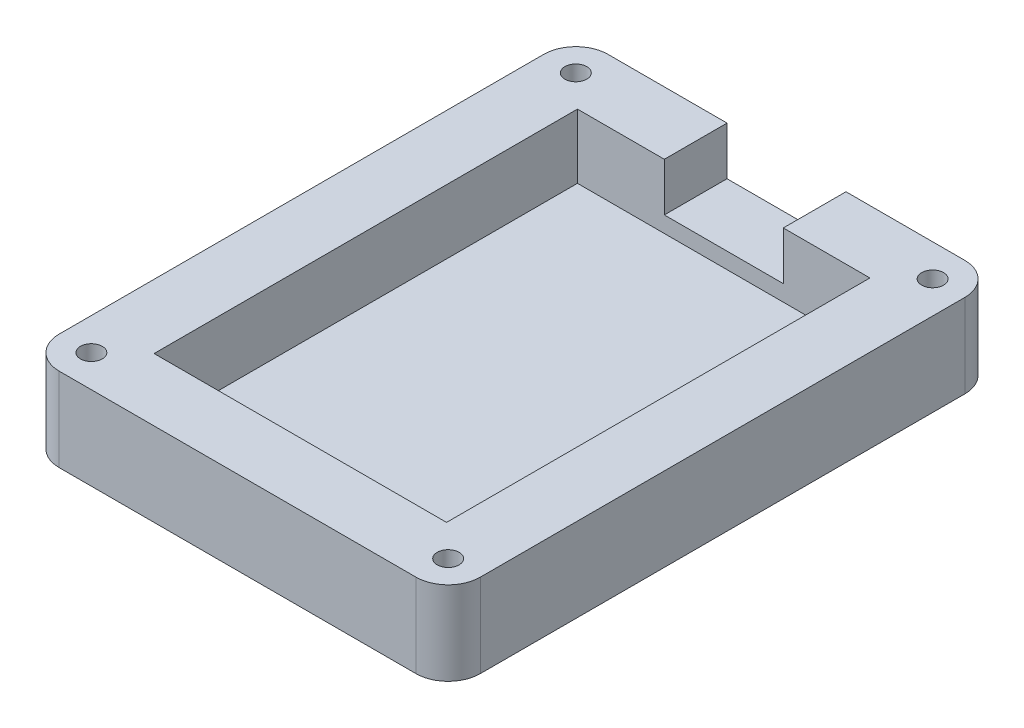
from build123d import *

# Parameters (mm, degrees)
BOSS_EXTRUDE1_START   = 3.1
SKETCH1_R             = 3
SKETCH1_R_2           = 1.7
BOSS_EXTRUDE1_DEPTH   = 9.9
BOSS_EXTRUDE1_2_DEPTH = 9.9
BOSS_EXTRUDE1_3_DEPTH = 9.9
BOSS_EXTRUDE1_4_DEPTH = 9.9
SKETCH1_5_W           = 65.49
SKETCH1_5_H           = 85.35
SKETCH1_5_R           = 3
SKETCH1_5_W_2         = 45.49
SKETCH1_5_H_2         = 65.85
BOSS_EXTRUDE2_DEPTH   = 13
SKETCH1_6_W           = 45.49
SKETCH1_6_H           = 65.85
BOSS_EXTRUDE3_DEPTH   = 3
SKETCH3_W             = 18.5
SKETCH3_H             = 9.75
CUT_EXTRUDE1_DEPTH    = 7.5
FILLET1_R             = 5
SKETCH4_W             = 0.32987013
SKETCH4_H             = 0.453571428
SKETCH4_H_2           = 2.30909091
CUT_EXTRUDE2_DEPTH    = 0.2


with BuildPart() as part:
    # Sketch1 → Boss-Extrude1 (new body)
    with BuildSketch(Plane(origin=(0, 0, 0), x_dir=(1, 0, 0), z_dir=(0, 1, 0)).offset(BOSS_EXTRUDE1_START)):
        with Locations((-27.745, -37.675)):
            Circle(SKETCH1_R)
        with Locations((-27.745, -37.675)):
            Circle(SKETCH1_R_2, mode=Mode.SUBTRACT)
    extrude(amount=BOSS_EXTRUDE1_DEPTH)



with BuildPart() as body_2:
    # Sketch1 → Boss-Extrude1 2 (new body)
    with BuildSketch(Plane(origin=(0, 0, 0), x_dir=(1, 0, 0), z_dir=(0, 1, 0)).offset(BOSS_EXTRUDE1_START)):
        with Locations((27.745, 37.675)):
            Circle(SKETCH1_R)
        with Locations((27.745, 37.675)):
            Circle(SKETCH1_R_2, mode=Mode.SUBTRACT)
    extrude(amount=BOSS_EXTRUDE1_2_DEPTH)


with BuildPart() as body_3:
    # Sketch1 → Boss-Extrude1 3 (new body)
    with BuildSketch(Plane(origin=(0, 0, 0), x_dir=(1, 0, 0), z_dir=(0, 1, 0)).offset(BOSS_EXTRUDE1_START)):
        with Locations((-27.745, 37.675)):
            Circle(SKETCH1_R)
        with Locations((-27.745, 37.675)):
            Circle(SKETCH1_R_2, mode=Mode.SUBTRACT)
    extrude(amount=BOSS_EXTRUDE1_3_DEPTH)


with BuildPart() as body_4:
    # Sketch1 → Boss-Extrude1 4 (new body)
    with BuildSketch(Plane(origin=(0, 0, 0), x_dir=(1, 0, 0), z_dir=(0, 1, 0)).offset(BOSS_EXTRUDE1_START)):
        with Locations((27.745, -37.675)):
            Circle(SKETCH1_R)
        with Locations((27.745, -37.675)):
            Circle(SKETCH1_R_2, mode=Mode.SUBTRACT)
    extrude(amount=BOSS_EXTRUDE1_4_DEPTH)


with BuildPart() as part_1:
    add(part.part)

    add(body_2.part)  # Boss-Extrude2 merges body 2

    add(body_3.part)  # Boss-Extrude2 merges body 3

    add(body_4.part)  # Boss-Extrude2 merges body 4
    # Sketch1<5> → Boss-Extrude2 (add)
    with BuildSketch(Plane(origin=(0, 0, 0), x_dir=(1, 0, 0), z_dir=(0, 1, 0))):
        Rectangle(SKETCH1_5_W, SKETCH1_5_H)
        with Locations((-27.745, -37.675)):
            Circle(SKETCH1_5_R, mode=Mode.SUBTRACT)
        with Locations((27.745, -37.675)):
            Circle(SKETCH1_5_R, mode=Mode.SUBTRACT)
        with Locations((-27.745, 37.675)):
            Circle(SKETCH1_5_R, mode=Mode.SUBTRACT)
        Rectangle(SKETCH1_5_W_2, SKETCH1_5_H_2, mode=Mode.SUBTRACT)
        with Locations((27.745, 37.675)):
            Circle(SKETCH1_5_R, mode=Mode.SUBTRACT)
    extrude(amount=BOSS_EXTRUDE2_DEPTH)

    # Sketch1<6> → Boss-Extrude3 (add)
    with BuildSketch(Plane(origin=(0, 0, 0), x_dir=(1, 0, 0), z_dir=(0, 1, 0))):
        Rectangle(SKETCH1_6_W, SKETCH1_6_H)
    extrude(amount=BOSS_EXTRUDE3_DEPTH)

    # Sketch3 → Cut-Extrude1 (cut)
    with BuildSketch(Plane(origin=(0, 13, 0), x_dir=(1, 0, 0), z_dir=(0, 1, 0))):
        with Locations((0.02, 37.8)):
            Rectangle(SKETCH3_W, SKETCH3_H)
    extrude(amount=-CUT_EXTRUDE1_DEPTH, mode=Mode.SUBTRACT)

    # Fillet1
    fillet1_edges = [part_1.edges().sort_by_distance(p)[0] for p in [
        (32.745, 6.5, -42.675),
        (-32.745, 6.5, -42.675),
        (-32.745, 6.5, 42.675),
        (32.745, 6.5, 42.675),
    ]]
    fillet(fillet1_edges, radius=FILLET1_R)

    # Sketch4 → Cut-Extrude2 (cut)
    # profile 1 of 12: a face of its own
    with BuildSketch(Plane.XZ):
        with BuildLine():
            Line((-10.153954036, 36.930294388), (-10.153954036, 37.316860947))
            Line((-10.153954036, 37.316860947), (-8.798393971, 39.355999543))
            add(Edge.make_bspline(
                [(-8.798393971, 39.355999543), (-8.775140859, 39.390682703), (-8.72975405, 39.458379362), (-8.660564953, 39.555893365), (-8.592471126, 39.647585696), (-8.546002443, 39.705755633), (-8.523287437, 39.734190492)],
                knots=[0, 0, 0, 0, 1.071007658, 2.09045659, 3.066569397, 4, 4, 4, 4], degree=3))
            Line((-8.523287437, 39.734190492), (-9.989018971, 39.734190492))
            Line((-9.989018971, 39.734190492), (-9.989018971, 40.105294388))
            Line((-9.989018971, 40.105294388), (-8.133499491, 40.105294388))
            Line((-8.133499491, 40.105294388), (-8.133499491, 39.734190492))
            Line((-8.133499491, 39.734190492), (-9.614693687, 37.524962611))
            Line((-9.614693687, 37.524962611), (-9.775118809, 37.301398285))
            Line((-9.775118809, 37.301398285), (-8.092265724, 37.301398285))
            Line((-8.092265724, 37.301398285), (-8.092265724, 36.930294388))
            Line((-8.092265724, 36.930294388), (-10.153954036, 36.930294388))
        make_face()
    # profile 2 of 12: a face of its own
    with BuildSketch(Plane.XZ):
        with BuildLine():
            add(Edge.make_bspline(
                [(-6.484148841, 37.248567522), (-6.51119617, 37.220197822), (-6.563779804, 37.165043322), (-6.648008255, 37.091861054), (-6.733910635, 37.029537785), (-6.821600008, 36.978211216), (-6.911151583, 36.938645122), (-7.001996437, 36.909803883), (-7.094913515, 36.892547741), (-7.157563401, 36.890225471), (-7.188988533, 36.889060622)],
                knots=[0, 0, 0, 0, 1.153539222, 2.242634972, 3.279759983, 4.274221825, 5.22822196, 6.156113319, 7.075107937, 8, 8, 8, 8], degree=3))
            add(Edge.make_bspline(
                [(-7.188988533, 36.889060622), (-7.213286595, 36.889458684), (-7.26074724, 36.890236204), (-7.330076767, 36.899144422), (-7.395825985, 36.912053999), (-7.457559482, 36.931920333), (-7.515912211, 36.956075851), (-7.570135083, 36.986707939), (-7.620938745, 37.02220796), (-7.667066597, 37.063604708), (-7.709095858, 37.109083477), (-7.745282284, 37.159231866), (-7.776466192, 37.212834037), (-7.80170181, 37.270563944), (-7.820750435, 37.332029683), (-7.835191034, 37.397052096), (-7.843563303, 37.465897643), (-7.844424259, 37.513128328), (-7.844863127, 37.537203885)],
                knots=[0, 0, 0, 0, 1.119001789, 2.185711136, 3.216323131, 4.202252203, 5.169072212, 6.121655869, 7.066185889, 8.01954035, 8.972175414, 9.914421449, 10.863296537, 11.8249363, 12.810865371, 13.824179086, 14.890888434, 16, 16, 16, 16], degree=3))
            add(Edge.make_bspline(
                [(-7.844863127, 37.537203885), (-7.844009478, 37.569282536), (-7.842347857, 37.631723347), (-7.8254319, 37.722342882), (-7.799412908, 37.807503397), (-7.761607044, 37.886437764), (-7.714844398, 37.958207134), (-7.6599792, 38.022516223), (-7.597044135, 38.078132433), (-7.538079041, 38.117759919), (-7.485670392, 38.145243414), (-7.441206431, 38.164327769), (-7.39213957, 38.182272871), (-7.338497028, 38.199245985), (-7.279852967, 38.213656244), (-7.216485622, 38.227274139), (-7.148352205, 38.239436488), (-7.101173252, 38.246261305), (-7.076884231, 38.249774908)],
                knots=[0, 0, 0, 0, 1.315736636, 2.561069718, 3.771447986, 4.962594692, 6.141438714, 7.279577219, 8.422657877, 9.579430637, 10.186831949, 10.850275834, 11.564458882, 12.331400109, 13.159047923, 14.042804356, 14.992381924, 16, 16, 16, 16], degree=3))
            add(Edge.make_bspline(
                [(-7.076884231, 38.249774908), (-7.044202564, 38.255370553), (-6.981046813, 38.266183868), (-6.890267605, 38.285121927), (-6.805946337, 38.304235379), (-6.72872959, 38.324910123), (-6.657625728, 38.345339377), (-6.593647347, 38.367247124), (-6.535859852, 38.389228695), (-6.500788101, 38.40651076), (-6.484148841, 38.414709973)],
                knots=[0, 0, 0, 0, 1.28905306, 2.491033145, 3.605049172, 4.650122195, 5.598672662, 6.480605859, 7.279146522, 8, 8, 8, 8], degree=3))
            Line((-6.484148841, 38.414709973), (-6.484148841, 38.508774502))
            add(Edge.make_bspline(
                [(-6.484148841, 38.508774502), (-6.484286612, 38.52661465), (-6.484551032, 38.560854738), (-6.489587526, 38.610047617), (-6.495518197, 38.655367401), (-6.504943971, 38.696688643), (-6.518208818, 38.733533584), (-6.532738782, 38.766913447), (-6.550581184, 38.79616701), (-6.565295616, 38.812636471), (-6.572414872, 38.820604859)],
                knots=[0, 0, 0, 0, 1.290137808, 2.476124807, 3.574920544, 4.596386969, 5.535069845, 6.404438809, 7.22802268, 8, 8, 8, 8], degree=3))
            add(Edge.make_bspline(
                [(-6.572414872, 38.820604859), (-6.583103494, 38.831007955), (-6.604738728, 38.852065246), (-6.642704675, 38.878393021), (-6.684719605, 38.900864327), (-6.730641348, 38.919654317), (-6.78076437, 38.933940148), (-6.835250284, 38.942996062), (-6.893732722, 38.949964427), (-6.934260876, 38.950482398), (-6.955115765, 38.950748934)],
                knots=[0, 0, 0, 0, 0.860333652, 1.741433159, 2.657216257, 3.608602534, 4.602004448, 5.660502074, 6.796146289, 8, 8, 8, 8], degree=3))
            add(Edge.make_bspline(
                [(-6.955115765, 38.950748934), (-6.991712264, 38.950067831), (-7.06019789, 38.948793235), (-7.155740744, 38.931585571), (-7.237368444, 38.905714521), (-7.294978886, 38.872864745), (-7.33318147, 38.839853691), (-7.359495651, 38.810977626), (-7.383337969, 38.777013872), (-7.405245592, 38.738498757), (-7.425961783, 38.695612282), (-7.443612844, 38.647281605), (-7.460720015, 38.594805346), (-7.469321575, 38.557603953), (-7.473759231, 38.538411272)],
                knots=[0, 0, 0, 0, 1.779102865, 3.329361478, 4.707868851, 5.930643941, 6.523657754, 7.16004944, 7.827207895, 8.539060925, 9.31524689, 10.142348672, 11.041613586, 12, 12, 12, 12], degree=3))
            Line((-7.473759231, 38.538411272), (-7.803629361, 38.579645038))
            add(Edge.make_bspline(
                [(-7.803629361, 38.579645038), (-7.797300937, 38.609143139), (-7.784969519, 38.666622445), (-7.761469669, 38.749356534), (-7.732217475, 38.825705935), (-7.699049174, 38.895870119), (-7.661298211, 38.959689721), (-7.619598845, 39.017628561), (-7.572054381, 39.068425297), (-7.520895772, 39.114282305), (-7.463983437, 39.153981829), (-7.40151679, 39.188057055), (-7.333052735, 39.216192598), (-7.259559277, 39.240421052), (-7.179801361, 39.257815159), (-7.094691302, 39.271679456), (-7.003571433, 39.279180492), (-6.940953952, 39.280130263), (-6.908727778, 39.280619064)],
                knots=[0, 0, 0, 0, 1.146744962, 2.234520216, 3.265547189, 4.251500875, 5.181194384, 6.080940409, 6.959092981, 7.820811418, 8.688273039, 9.590681915, 10.520124471, 11.498613844, 12.528476545, 13.619677679, 14.774963812, 16, 16, 16, 16], degree=3))
            add(Edge.make_bspline(
                [(-6.908727778, 39.280619064), (-6.883590936, 39.280228748), (-6.834766532, 39.279470622), (-6.763597413, 39.274163371), (-6.696625921, 39.266128054), (-6.633705974, 39.253975368), (-6.575156371, 39.237520508), (-6.520120432, 39.219347958), (-6.469540726, 39.196793638), (-6.409794392, 39.161850744), (-6.344086196, 39.113309147), (-6.278086465, 39.047704341), (-6.22977669, 38.973578788), (-6.203210805, 38.906153384), (-6.189074715, 38.848119608), (-6.179301554, 38.800013059), (-6.171845517, 38.746839209), (-6.165434635, 38.689041606), (-6.160397445, 38.626515475), (-6.156376495, 38.559505241), (-6.1546681, 38.487737217), (-6.154411469, 38.438333912), (-6.154278711, 38.41277714)],
                knots=[0, 0, 0, 0, 1.116479382, 2.168587404, 3.16840818, 4.111316371, 5.011567079, 5.868311402, 6.683862369, 7.465978748, 8.938885496, 10.301521261, 11.576846205, 12.839874513, 13.499268829, 14.228894422, 15.019458851, 15.883290383, 16.811756148, 17.805505868, 18.864768531, 20, 20, 20, 20], degree=3))
            Line((-6.154278711, 38.41277714), (-6.154278711, 37.893489397))
            add(Edge.make_bspline(
                [(-6.154278711, 37.893489397), (-6.154418221, 37.85010716), (-6.154683434, 37.767635598), (-6.152906608, 37.650168508), (-6.152059679, 37.545354349), (-6.149711442, 37.45302179), (-6.148465101, 37.373303924), (-6.144812257, 37.306328244), (-6.142004696, 37.251942152), (-6.134766413, 37.172825642), (-6.115504284, 37.065439676), (-6.086369546, 36.975324256), (-6.071811179, 36.930294388)],
                knots=[0, 0, 0, 0, 1.33924071, 2.545956183, 3.626711962, 4.574996917, 5.397345641, 6.087652113, 6.645549812, 7.078325684, 8.540065522, 10, 10, 10, 10], degree=3))
            Line((-6.071811179, 36.930294388), (-6.401681309, 36.930294388))
            add(Edge.make_bspline(
                [(-6.401681309, 36.930294388), (-6.411835741, 36.953520035), (-6.432613532, 37.001043877), (-6.455231289, 37.078124631), (-6.473579444, 37.160968375), (-6.480563089, 37.218848817), (-6.484148841, 37.248567522)],
                knots=[0, 0, 0, 0, 0.920202936, 1.882900402, 2.912975517, 4, 4, 4, 4], degree=3))
        make_face()
        with BuildLine():
            add(Edge.make_bspline(
                [(-6.484148841, 38.084839843), (-6.500612846, 38.076738216), (-6.534866969, 38.059882407), (-6.58985572, 38.036702593), (-6.65051178, 38.014808962), (-6.717186321, 37.994640088), (-6.78915199, 37.973666676), (-6.867016953, 37.954624504), (-6.9504162, 37.936587879), (-7.007922017, 37.925581715), (-7.037583298, 37.919904778)],
                knots=[0, 0, 0, 0, 0.759937497, 1.581085096, 2.470290631, 3.429739441, 4.465916236, 5.57487507, 6.749129853, 8, 8, 8, 8], degree=3))
            add(Edge.make_bspline(
                [(-7.037583298, 37.919904778), (-7.070479327, 37.914551228), (-7.131104295, 37.904685028), (-7.214140848, 37.887851914), (-7.28094838, 37.868963113), (-7.333930949, 37.848757293), (-7.376049193, 37.825011339), (-7.41184529, 37.797721093), (-7.443159356, 37.766022666), (-7.468788571, 37.72967895), (-7.489536728, 37.690317138), (-7.504739819, 37.647879857), (-7.512869962, 37.602369766), (-7.514275739, 37.571165008), (-7.514992997, 37.555243658)],
                knots=[0, 0, 0, 0, 1.792080477, 3.302672748, 4.55256871, 5.521793876, 6.343933024, 7.143043091, 7.93511388, 8.729789758, 9.525220353, 10.321404951, 11.1435441, 12, 12, 12, 12], degree=3))
            add(Edge.make_bspline(
                [(-7.514992997, 37.555243658), (-7.514030311, 37.530786508), (-7.512176617, 37.483693183), (-7.489989342, 37.417299243), (-7.456463456, 37.35797038), (-7.408185293, 37.307819282), (-7.348259523, 37.267543468), (-7.277034085, 37.239464186), (-7.196077406, 37.221745041), (-7.138621002, 37.21989966), (-7.108453833, 37.218930752)],
                knots=[0, 0, 0, 0, 0.982989349, 1.89278952, 2.793465746, 3.712871111, 4.674195932, 5.684718148, 6.784373966, 8, 8, 8, 8], degree=3))
            add(Edge.make_bspline(
                [(-7.108453833, 37.218930752), (-7.078949687, 37.219821958), (-7.020773246, 37.221579243), (-6.93573785, 37.238524247), (-6.854473064, 37.264622534), (-6.778677998, 37.302309786), (-6.70931755, 37.348107943), (-6.64866269, 37.402243531), (-6.597158368, 37.46322932), (-6.562303978, 37.520454325), (-6.539263352, 37.57061825), (-6.524437449, 37.612686169), (-6.512722942, 37.658761757), (-6.501068885, 37.70839717), (-6.494102564, 37.762591214), (-6.48799326, 37.820565045), (-6.485026097, 37.882721865), (-6.484447927, 37.925486636), (-6.484148841, 37.947608715)],
                knots=[0, 0, 0, 0, 1.295816986, 2.555099171, 3.797272685, 5.038800039, 6.264426397, 7.441439978, 8.600861566, 9.761973723, 10.374641393, 11.025690135, 11.719692907, 12.46426932, 13.265486335, 14.119543836, 15.027246062, 16, 16, 16, 16], degree=3))
            Line((-6.484148841, 37.947608715), (-6.484148841, 38.084839843))
        make_face(mode=Mode.SUBTRACT)
    # profile 3 of 12: a face of its own
    with BuildSketch(Plane.XZ):
        with BuildLine():
            Line((-5.741941049, 36.064385298), (-5.783174815, 36.47672296))
            add(Edge.make_bspline(
                [(-5.783174815, 36.47672296), (-5.768240948, 36.470436558), (-5.739836042, 36.45847953), (-5.697975131, 36.445711429), (-5.659391087, 36.437137352), (-5.63460082, 36.436022267), (-5.622749694, 36.435489194)],
                knots=[0, 0, 0, 0, 1.165471902, 2.21678153, 3.147522386, 4, 4, 4, 4], degree=3))
            add(Edge.make_bspline(
                [(-5.622749694, 36.435489194), (-5.608340511, 36.435831141), (-5.580683776, 36.436487467), (-5.541308304, 36.442225682), (-5.505958297, 36.45182863), (-5.474201847, 36.465606761), (-5.445744791, 36.483701465), (-5.420210695, 36.506313666), (-5.396633545, 36.532550225), (-5.384255886, 36.553158473), (-5.377924207, 36.563700436)],
                knots=[0, 0, 0, 0, 1.185035572, 2.274536785, 3.264811362, 4.190559477, 5.112082338, 6.026292085, 6.990367657, 8, 8, 8, 8], degree=3))
            add(Edge.make_bspline(
                [(-5.377924207, 36.563700436), (-5.376184213, 36.56777186), (-5.371105264, 36.579656128), (-5.362074907, 36.603866178), (-5.350138967, 36.640489784), (-5.334801856, 36.689563006), (-5.315322046, 36.750936824), (-5.292291109, 36.824583333), (-5.265673821, 36.910641587), (-5.247294356, 36.972155356), (-5.23747169, 37.00503059)],
                knots=[0, 0, 0, 0, 0.229371289, 0.669522359, 1.338017403, 2.224764623, 3.333198648, 4.673933361, 6.222426913, 8, 8, 8, 8], degree=3))
            Line((-5.23747169, 37.00503059), (-5.906876114, 39.239385298))
            Line((-5.906876114, 39.239385298), (-5.56476471, 39.239385298))
            Line((-5.56476471, 39.239385298), (-5.208479198, 37.9997952))
            add(Edge.make_bspline(
                [(-5.208479198, 37.9997952), (-5.186587111, 37.920061793), (-5.141519233, 37.755919588), (-5.104472935, 37.589781099), (-5.085422177, 37.504345728)],
                knots=[0, 0, 0, 0, 0.971516218, 2, 2, 2, 2], degree=3))
            add(Edge.make_bspline(
                [(-5.085422177, 37.504345728), (-5.066862544, 37.586857172), (-5.029949821, 37.750961825), (-4.981366616, 37.911996874), (-4.957210936, 37.992063869)],
                knots=[0, 0, 0, 0, 1.005595425, 2, 2, 2, 2], degree=3))
            Line((-4.957210936, 37.992063869), (-4.55904738, 39.239385298))
            Line((-4.55904738, 39.239385298), (-4.216291698, 39.239385298))
            Line((-4.216291698, 39.239385298), (-4.929506999, 36.890993455))
            add(Edge.make_bspline(
                [(-4.929506999, 36.890993455), (-4.940414422, 36.855759002), (-4.961324013, 36.788214363), (-4.992068601, 36.691436868), (-5.021645061, 36.604068614), (-5.049525198, 36.525734196), (-5.075047162, 36.456483752), (-5.098530153, 36.396290629), (-5.121405255, 36.345804457), (-5.147809619, 36.291246788), (-5.181806577, 36.234152936), (-5.223782611, 36.174414543), (-5.270203937, 36.12626086), (-5.318727078, 36.087385876), (-5.370834247, 36.058724161), (-5.425566723, 36.037668428), (-5.483883813, 36.025195414), (-5.523901649, 36.02383819), (-5.544147827, 36.023151531)],
                knots=[0, 0, 0, 0, 1.54772604, 2.966999321, 4.260793617, 5.418012451, 6.455881169, 7.357858617, 8.128290321, 8.781185485, 9.9001574, 10.913198716, 11.83736709, 12.697308749, 13.512204708, 14.32225288, 15.151179359, 16, 16, 16, 16], degree=3))
            add(Edge.make_bspline(
                [(-5.544147827, 36.023151531), (-5.5592106, 36.023688917), (-5.590590711, 36.024808447), (-5.638876965, 36.03307706), (-5.689978565, 36.045887492), (-5.724208373, 36.058072751), (-5.741941049, 36.064385298)],
                knots=[0, 0, 0, 0, 0.889897906, 1.853914517, 2.888225146, 4, 4, 4, 4], degree=3))
        make_face()
    # profile 4 of 12: a face of its own
    with BuildSketch(Plane.XZ):
        with BuildLine():
            Line((-2.731876114, 36.930294388), (-2.731876114, 37.240191913))
            add(Edge.make_bspline(
                [(-2.731876114, 37.240191913), (-2.746422798, 37.212912474), (-2.774711161, 37.159863224), (-2.827826947, 37.089343604), (-2.885799702, 37.02775422), (-2.950423512, 36.97768803), (-3.018825405, 36.937880776), (-3.090783929, 36.909913692), (-3.165504492, 36.892473706), (-3.216494503, 36.890202903), (-3.242143971, 36.889060622)],
                knots=[0, 0, 0, 0, 1.133989571, 2.205224826, 3.231789394, 4.232199063, 5.19692309, 6.128572225, 7.058617027, 8, 8, 8, 8], degree=3))
            add(Edge.make_bspline(
                [(-3.242143971, 36.889060622), (-3.26904683, 36.890143816), (-3.322364558, 36.892290555), (-3.401082764, 36.906689358), (-3.477143222, 36.931357322), (-3.550017356, 36.966581569), (-3.620266365, 37.010862497), (-3.687712318, 37.064850342), (-3.751996294, 37.128993988), (-3.813154335, 37.202298424), (-3.869008619, 37.284615293), (-3.918361536, 37.375313259), (-3.959211422, 37.474432876), (-3.99349468, 37.581025346), (-4.019785164, 37.695705518), (-4.038176954, 37.818256282), (-4.049134682, 37.948911992), (-4.050601507, 38.038644993), (-4.051356634, 38.084839843)],
                knots=[0, 0, 0, 0, 0.80447131, 1.594350407, 2.384438369, 3.188807121, 4.008491784, 4.86308786, 5.766854884, 6.719939474, 7.713954355, 8.737069496, 9.802239073, 10.915301486, 12.082206997, 13.316639229, 14.618596865, 16, 16, 16, 16], degree=3))
            add(Edge.make_bspline(
                [(-4.051356634, 38.084839843), (-4.050873193, 38.116627225), (-4.049922182, 38.179158552), (-4.045772128, 38.271189151), (-4.037223419, 38.35950707), (-4.025762407, 38.444004424), (-4.010898645, 38.524837013), (-3.992986364, 38.602062608), (-3.971809634, 38.675659453), (-3.947199782, 38.745235812), (-3.920353486, 38.810939251), (-3.890639911, 38.872479925), (-3.858339463, 38.929420291), (-3.825258886, 38.982751694), (-3.788691707, 39.03075885), (-3.749963062, 39.074488362), (-3.709740807, 39.114663152), (-3.6530495, 39.160673748), (-3.578062865, 39.2085291), (-3.481824487, 39.250303452), (-3.380255225, 39.27582845), (-3.31079744, 39.279009305), (-3.275646406, 39.280619064)],
                knots=[0, 0, 0, 0, 1.200092811, 2.360791942, 3.476449651, 4.548454459, 5.57884996, 6.577830464, 7.53997948, 8.46815932, 9.362439314, 10.218148121, 11.045744559, 11.832923925, 12.585266996, 13.320466941, 14.037060379, 14.728399049, 16.073317711, 17.380543445, 18.674351532, 20, 20, 20, 20], degree=3))
            add(Edge.make_bspline(
                [(-3.275646406, 39.280619064), (-3.250434475, 39.279686938), (-3.200341848, 39.277834933), (-3.126846089, 39.261124983), (-3.056520629, 39.233569893), (-2.989386005, 39.195987827), (-2.926379104, 39.14896686), (-2.86852408, 39.092964389), (-2.816570607, 39.028193225), (-2.787794546, 38.979902195), (-2.77310988, 38.955258877)],
                knots=[0, 0, 0, 0, 0.96180372, 1.910971261, 2.861342746, 3.837963269, 4.840179112, 5.855199082, 6.905490109, 8, 8, 8, 8], degree=3))
            Line((-2.77310988, 38.955258877), (-2.77310988, 40.105294388))
            Line((-2.77310988, 40.105294388), (-2.402005984, 40.105294388))
            Line((-2.402005984, 40.105294388), (-2.402005984, 36.930294388))
            Line((-2.402005984, 36.930294388), (-2.731876114, 36.930294388))
        make_face()
        with BuildLine():
            add(Edge.make_bspline(
                [(-3.721486504, 38.08290701), (-3.720980443, 38.047458422), (-3.720000994, 37.978849933), (-3.712838626, 37.879715852), (-3.701607828, 37.787546139), (-3.68479875, 37.70255952), (-3.66394474, 37.624155346), (-3.63742949, 37.553051631), (-3.606648879, 37.488801075), (-3.571128928, 37.431962138), (-3.532239127, 37.382280998), (-3.491636326, 37.338757596), (-3.449309197, 37.301983074), (-3.405351663, 37.27193901), (-3.360417733, 37.24727413), (-3.312664936, 37.231816795), (-3.264146257, 37.22052394), (-3.231042807, 37.219462906), (-3.214440035, 37.218930752)],
                knots=[0, 0, 0, 0, 1.533575963, 2.968138773, 4.298114002, 5.54818033, 6.713535028, 7.804307417, 8.826602252, 9.790834069, 10.697855259, 11.552385841, 12.362681251, 13.117825955, 13.853512655, 14.570478034, 15.283034621, 16, 16, 16, 16], degree=3))
            add(Edge.make_bspline(
                [(-3.214440035, 37.218930752), (-3.198070527, 37.219541923), (-3.165473216, 37.220758973), (-3.117349673, 37.230856809), (-3.071063917, 37.246955306), (-3.026232183, 37.269169721), (-2.983973954, 37.298748156), (-2.942146121, 37.333503436), (-2.903264031, 37.375806891), (-2.865735024, 37.423646757), (-2.830398311, 37.477589554), (-2.80157998, 37.539378538), (-2.775128413, 37.606674401), (-2.755094462, 37.681100372), (-2.739056453, 37.761818343), (-2.727440519, 37.848959088), (-2.721365604, 37.942582402), (-2.720224057, 38.00708909), (-2.71963484, 38.040384689)],
                knots=[0, 0, 0, 0, 0.738130652, 1.469871548, 2.208510992, 2.945304392, 3.719456284, 4.530982887, 5.394868195, 6.306056086, 7.273827841, 8.29675308, 9.376626023, 10.533467898, 11.768870438, 13.088773566, 14.497349183, 16, 16, 16, 16], degree=3))
            add(Edge.make_bspline(
                [(-2.71963484, 38.040384689), (-2.720219703, 38.07861874), (-2.721347571, 38.152350537), (-2.727412793, 38.259052989), (-2.739025664, 38.357772706), (-2.754926629, 38.448601953), (-2.775035596, 38.531556093), (-2.801211141, 38.605876788), (-2.830346916, 38.67305123), (-2.865338814, 38.731725956), (-2.903760455, 38.782777714), (-2.943753828, 38.8279846), (-2.986675906, 38.866074928), (-3.032418883, 38.896595192), (-3.080072562, 38.921047962), (-3.130371453, 38.93832529), (-3.183268726, 38.949135574), (-3.219327229, 38.950205656), (-3.237634028, 38.950748934)],
                knots=[0, 0, 0, 0, 1.573905954, 3.035171796, 4.397009854, 5.662881359, 6.829217105, 7.905549714, 8.902740008, 9.838145653, 10.709765189, 11.529785453, 12.318969519, 13.06430776, 13.787779745, 14.517436054, 15.247306526, 16, 16, 16, 16], degree=3))
            add(Edge.make_bspline(
                [(-3.237634028, 38.950748934), (-3.253998278, 38.950129678), (-3.286374604, 38.948904494), (-3.334047389, 38.939089393), (-3.379275237, 38.921857177), (-3.423302241, 38.899181894), (-3.465064227, 38.868935276), (-3.506095901, 38.8330453), (-3.543560669, 38.789035377), (-3.58086546, 38.740287324), (-3.614512127, 38.683850578), (-3.643215616, 38.619749698), (-3.667736432, 38.548367398), (-3.687389856, 38.469653373), (-3.702847109, 38.383551621), (-3.713281876, 38.289918306), (-3.720847546, 38.188906358), (-3.721268925, 38.11900215), (-3.721486504, 38.08290701)],
                knots=[0, 0, 0, 0, 0.713457296, 1.411560271, 2.111044511, 2.819131589, 3.565057044, 4.354641503, 5.190909952, 6.0808078, 7.030242707, 8.048917332, 9.139076782, 10.318209453, 11.584188125, 12.951756445, 14.426035021, 16, 16, 16, 16], degree=3))
        make_face(mode=Mode.SUBTRACT)
    # profile 5 of 12: a face of its own
    with BuildSketch(Plane.XZ):
        Polygon((-1.914932121, 38.9919827), (-1.989668322, 39.569255427), (-1.989668322, 40.105294388), (-1.659798192, 40.105294388), (-1.659798192, 39.569255427), (-1.736467226, 38.9919827), align=None)
    # profile 6 of 12: a face of its own
    with BuildSketch(Plane.XZ):
        with BuildLine():
            Line((-1.371161828, 37.631268414), (-1.041291698, 37.672502181))
            add(Edge.make_bspline(
                [(-1.041291698, 37.672502181), (-1.03570969, 37.636401398), (-1.025128819, 37.567971246), (-0.99333532, 37.473502583), (-0.949729971, 37.393363606), (-0.89289338, 37.328300314), (-0.824467697, 37.278540383), (-0.745629295, 37.243572838), (-0.656870134, 37.222660809), (-0.594496644, 37.220209753), (-0.561949166, 37.218930752)],
                knots=[0, 0, 0, 0, 1.189281864, 2.254320617, 3.232274242, 4.145201865, 5.047107826, 5.968481238, 6.939921219, 8, 8, 8, 8], degree=3))
            add(Edge.make_bspline(
                [(-0.561949166, 37.218930752), (-0.529629474, 37.220055858), (-0.468464593, 37.222185117), (-0.382255851, 37.241020822), (-0.307194058, 37.272199075), (-0.245201015, 37.317638572), (-0.195945362, 37.372011786), (-0.159159426, 37.433725964), (-0.138070045, 37.503443972), (-0.135481655, 37.552096788), (-0.134148841, 37.577149096)],
                knots=[0, 0, 0, 0, 1.234162119, 2.335646571, 3.354322508, 4.318233937, 5.248195862, 6.142280526, 7.043423072, 8, 8, 8, 8], degree=3))
            add(Edge.make_bspline(
                [(-0.134148841, 37.577149096), (-0.134856589, 37.598505999), (-0.136204277, 37.639173647), (-0.150631992, 37.696335239), (-0.174454151, 37.746377457), (-0.197922457, 37.773249196), (-0.20952932, 37.786539315)],
                knots=[0, 0, 0, 0, 1.120009958, 2.132714175, 3.076485076, 4, 4, 4, 4], degree=3))
            add(Edge.make_bspline(
                [(-0.20952932, 37.786539315), (-0.214795263, 37.790977498), (-0.227000641, 37.801264299), (-0.250309933, 37.814682632), (-0.279486788, 37.82963391), (-0.31522476, 37.845095043), (-0.357622667, 37.860660336), (-0.406153196, 37.878498781), (-0.461283563, 37.896150371), (-0.500295981, 37.90793704), (-0.5207154, 37.91410628)],
                knots=[0, 0, 0, 0, 0.488033344, 1.131161561, 1.901529161, 2.816272222, 3.89210763, 5.107205245, 6.485887592, 8, 8, 8, 8], degree=3))
            add(Edge.make_bspline(
                [(-0.5207154, 37.91410628), (-0.550808242, 37.92325597), (-0.608518223, 37.940802617), (-0.691147604, 37.967403071), (-0.766504771, 37.992206756), (-0.834417962, 38.016650395), (-0.894718008, 38.040762937), (-0.948528853, 38.062322888), (-0.994901767, 38.083322999), (-1.045975275, 38.110499545), (-1.101811754, 38.147021151), (-1.160771211, 38.197240002), (-1.211432595, 38.254681137), (-1.254345585, 38.317921613), (-1.287663648, 38.387301995), (-1.312723019, 38.461378407), (-1.326706892, 38.540465382), (-1.328842254, 38.594626858), (-1.329928062, 38.622167359)],
                knots=[0, 0, 0, 0, 1.285567247, 2.465372316, 3.547942052, 4.528124874, 5.414867895, 6.202193361, 6.897424025, 7.494322112, 8.565551231, 9.617619906, 10.649836794, 11.686968674, 12.731245229, 13.786056767, 14.87423479, 16, 16, 16, 16], degree=3))
            add(Edge.make_bspline(
                [(-1.329928062, 38.622167359), (-1.32930451, 38.646037719), (-1.328086495, 38.692664902), (-1.318673619, 38.761002829), (-1.304255098, 38.826103343), (-1.282980644, 38.88779382), (-1.254729533, 38.945260131), (-1.22192679, 39.000061801), (-1.182228738, 39.051183095), (-1.136566769, 39.098553115), (-1.08603458, 39.141903741), (-1.029726169, 39.1788042), (-0.969130657, 39.21045679), (-0.903666521, 39.236210993), (-0.833752916, 39.25624107), (-0.759300484, 39.269984138), (-0.680318268, 39.279633299), (-0.625978679, 39.280284245), (-0.598028711, 39.280619064)],
                knots=[0, 0, 0, 0, 1.030981229, 2.013867803, 2.975009643, 3.908154563, 4.825293019, 5.737112229, 6.663218639, 7.614772901, 8.57591474, 9.533242064, 10.516829137, 11.524797792, 12.56736321, 13.653765094, 14.793196781, 16, 16, 16, 16], degree=3))
            add(Edge.make_bspline(
                [(-0.598028711, 39.280619064), (-0.562979777, 39.279557385), (-0.494733745, 39.277490122), (-0.39563632, 39.263546794), (-0.30314513, 39.238816105), (-0.217855654, 39.204806763), (-0.140193923, 39.163185726), (-0.071960865, 39.113950189), (-0.013306145, 39.05812146), (0.036637933, 38.994700462), (0.077197239, 38.92013464), (0.110179369, 38.832923797), (0.137347971, 38.731934416), (0.148565392, 38.659251207), (0.154487522, 38.620878804)],
                knots=[0, 0, 0, 0, 1.129175769, 2.198690688, 3.215779298, 4.206399659, 5.150677169, 6.047525639, 6.908839248, 7.7517529, 8.637509676, 9.632036873, 10.749856573, 12, 12, 12, 12], degree=3))
            Line((0.154487522, 38.620878804), (-0.175382608, 38.579645038))
            add(Edge.make_bspline(
                [(-0.175382608, 38.579645038), (-0.179903049, 38.608811788), (-0.188494617, 38.66424623), (-0.214068571, 38.741233741), (-0.251340747, 38.805901828), (-0.297844431, 38.860181142), (-0.356043921, 38.901180597), (-0.424013074, 38.930433335), (-0.50202484, 38.947886925), (-0.557344791, 38.949762675), (-0.586431715, 38.950748934)],
                knots=[0, 0, 0, 0, 1.1431212, 2.172620705, 3.123755036, 4.020570385, 4.921665579, 5.857517289, 6.873494463, 8, 8, 8, 8], degree=3))
            add(Edge.make_bspline(
                [(-0.586431715, 38.950748934), (-0.619145398, 38.949866953), (-0.680444798, 38.948214282), (-0.765915131, 38.933451943), (-0.838928753, 38.909861587), (-0.898108789, 38.874668528), (-0.943489716, 38.831503143), (-0.97618028, 38.78247152), (-0.996687759, 38.727438645), (-0.998916924, 38.68849092), (-1.000057932, 38.668555346)],
                knots=[0, 0, 0, 0, 1.395580077, 2.6150593, 3.690777698, 4.653104214, 5.528564533, 6.342314364, 7.151505917, 8, 8, 8, 8], degree=3))
            add(Edge.make_bspline(
                [(-1.000057932, 38.668555346), (-0.998965542, 38.649236548), (-0.996826668, 38.611410826), (-0.975615352, 38.558711627), (-0.942321573, 38.511942629), (-0.911674602, 38.488691554), (-0.895684961, 38.476560622)],
                knots=[0, 0, 0, 0, 1.01333812, 1.98409065, 2.948226741, 4, 4, 4, 4], degree=3))
            add(Edge.make_bspline(
                [(-0.895684961, 38.476560622), (-0.889289685, 38.472820826), (-0.87426667, 38.464035746), (-0.84707673, 38.451457429), (-0.812222996, 38.437350472), (-0.769670155, 38.422301948), (-0.719863412, 38.404426293), (-0.66202162, 38.386373482), (-0.596747937, 38.365238749), (-0.550389872, 38.351663889), (-0.525869621, 38.344483715)],
                knots=[0, 0, 0, 0, 0.451775428, 1.061256619, 1.825217529, 2.745334864, 3.814398542, 5.053265661, 6.441378765, 8, 8, 8, 8], degree=3))
            add(Edge.make_bspline(
                [(-0.525869621, 38.344483715), (-0.494047934, 38.334940129), (-0.433472067, 38.316772928), (-0.34758339, 38.288969393), (-0.270863746, 38.262644874), (-0.203323775, 38.237735017), (-0.145008098, 38.214017926), (-0.096204368, 38.191288929), (-0.055659822, 38.171487033), (-0.015339673, 38.144510134), (0.026684013, 38.108983242), (0.070428796, 38.060793909), (0.107911193, 38.005400899), (0.139537144, 37.943303552), (0.164340326, 37.874638582), (0.183571367, 37.800122417), (0.193262889, 37.718929003), (0.194882977, 37.662858908), (0.195721289, 37.633845525)],
                knots=[0, 0, 0, 0, 1.4208324, 2.704701155, 3.860775016, 4.889580377, 5.783364499, 6.551894129, 7.192743352, 7.709885825, 8.62249147, 9.539385676, 10.484551591, 11.474534214, 12.511954784, 13.601300886, 14.758796889, 16, 16, 16, 16], degree=3))
            add(Edge.make_bspline(
                [(0.195721289, 37.633845525), (0.195108152, 37.606761236), (0.193906993, 37.553702089), (0.184323075, 37.475946439), (0.167172903, 37.402377686), (0.145198806, 37.332269407), (0.114826989, 37.266725032), (0.079039119, 37.204689916), (0.035966277, 37.147016239), (-0.012867039, 37.09351978), (-0.067527094, 37.045377872), (-0.126933914, 37.003088649), (-0.191634049, 36.968238108), (-0.260796038, 36.939020471), (-0.335134404, 36.916642656), (-0.414066909, 36.90065603), (-0.497700086, 36.89077234), (-0.555048801, 36.889641393), (-0.584498882, 36.889060622)],
                knots=[0, 0, 0, 0, 1.067785082, 2.091831323, 3.081950917, 4.043300278, 4.98307574, 5.924185488, 6.862433727, 7.815392752, 8.775286569, 9.729148088, 10.68406144, 11.666985355, 12.684886385, 13.739427528, 14.839136272, 16, 16, 16, 16], degree=3))
            add(Edge.make_bspline(
                [(-0.584498882, 36.889060622), (-0.612004688, 36.889771981), (-0.665641785, 36.891159152), (-0.744182559, 36.899273402), (-0.817997037, 36.914292141), (-0.887906496, 36.933999095), (-0.952704024, 36.960568419), (-1.013651965, 36.992253981), (-1.069470825, 37.030538022), (-1.121805916, 37.073813849), (-1.168547147, 37.123820129), (-1.21172191, 37.178954112), (-1.249335587, 37.240388013), (-1.283251991, 37.307280831), (-1.311907845, 37.380092977), (-1.336310682, 37.458750349), (-1.357249338, 37.542769441), (-1.36645532, 37.601329765), (-1.371161828, 37.631268414)],
                knots=[0, 0, 0, 0, 1.0975712, 2.140294732, 3.145156112, 4.099659636, 5.033637147, 5.934321845, 6.835006543, 7.729105615, 8.638227824, 9.560299488, 10.518487775, 11.507108274, 12.549268399, 13.63594966, 14.791392054, 16, 16, 16, 16], degree=3))
        make_face()
    # profile 7 of 12: a face of its own
    with BuildSketch(Plane.XZ):
        Polygon((1.680136873, 36.930294388), (1.680136873, 40.105294388), (3.453188821, 40.105294388), (3.453188821, 39.734190492), (2.010007003, 39.734190492), (2.010007003, 38.744580103), (3.24701999, 38.744580103), (3.24701999, 38.373476207), (2.010007003, 38.373476207), (2.010007003, 36.930294388), align=None)
    # profile 8 of 12: a face of its own
    with BuildSketch(Plane.XZ):
        with Locations((4.030461548, 39.878508674)):
            Rectangle(SKETCH4_W, SKETCH4_H)
    # profile 9 of 12: a face of its own
    with BuildSketch(Plane.XZ):
        with Locations((4.030461548, 38.084839843)):
            Rectangle(SKETCH4_W, SKETCH4_H_2)
    # profile 10 of 12: a face of its own
    with BuildSketch(Plane.XZ):
        with BuildLine():
            Line((4.690201808, 36.930294388), (4.690201808, 39.239385298))
            Line((4.690201808, 39.239385298), (5.020071938, 39.239385298))
            Line((5.020071938, 39.239385298), (5.020071938, 38.870858512))
            add(Edge.make_bspline(
                [(5.020071938, 38.870858512), (5.028488628, 38.890695525), (5.044711068, 38.928929647), (5.07084864, 38.982695699), (5.094922324, 39.032116224), (5.119554292, 39.075783697), (5.143060326, 39.114499146), (5.166544064, 39.147845407), (5.189284938, 39.17592374), (5.218364837, 39.206033145), (5.256231721, 39.235709586), (5.304644593, 39.262036497), (5.356523549, 39.277611045), (5.391933173, 39.279608048), (5.409859884, 39.280619064)],
                knots=[0, 0, 0, 0, 1.289569891, 2.485534132, 3.577799513, 4.579141338, 5.485278766, 6.287741315, 7.018535776, 7.645783751, 8.790134626, 9.882778151, 10.92812119, 12, 12, 12, 12], degree=3))
            add(Edge.make_bspline(
                [(5.409859884, 39.280619064), (5.435591892, 39.279084531), (5.488277962, 39.275942588), (5.566778376, 39.250664586), (5.646139954, 39.212052854), (5.695374467, 39.175813449), (5.721045964, 39.156917765)],
                knots=[0, 0, 0, 0, 0.90443484, 1.851822771, 2.879913239, 4, 4, 4, 4], degree=3))
            Line((5.721045964, 39.156917765), (5.597344665, 38.827047635))
            add(Edge.make_bspline(
                [(5.597344665, 38.827047635), (5.57832416, 38.833384808), (5.541104988, 38.845785337), (5.484606298, 38.858593215), (5.428999804, 38.866762315), (5.392062282, 38.867778466), (5.373780339, 38.868281401)],
                knots=[0, 0, 0, 0, 1.052765664, 2.060043406, 3.039833393, 4, 4, 4, 4], degree=3))
            add(Edge.make_bspline(
                [(5.373780339, 38.868281401), (5.357560597, 38.867469059), (5.325397902, 38.865858236), (5.27868766, 38.851069536), (5.23349649, 38.829381276), (5.192253583, 38.797349849), (5.154160456, 38.758612385), (5.122936558, 38.711552353), (5.096562345, 38.658132777), (5.084795721, 38.619159548), (5.078701199, 38.598973366)],
                knots=[0, 0, 0, 0, 0.90278596, 1.790165981, 2.712081054, 3.687667699, 4.687827769, 5.731629286, 6.825097509, 8, 8, 8, 8], degree=3))
            add(Edge.make_bspline(
                [(5.078701199, 38.598973366), (5.06953199, 38.561507932), (5.051058136, 38.486023675), (5.033733451, 38.369389881), (5.022339358, 38.249573937), (5.020833482, 38.168408655), (5.020071938, 38.127362164)],
                knots=[0, 0, 0, 0, 0.970935534, 1.956212433, 2.966426232, 4, 4, 4, 4], degree=3))
            Line((5.020071938, 38.127362164), (5.020071938, 36.930294388))
            Line((5.020071938, 36.930294388), (4.690201808, 36.930294388))
        make_face()
    # profile 11 of 12: a face of its own
    with BuildSketch(Plane.XZ):
        with BuildLine():
            Line((5.721045964, 37.631268414), (6.050916094, 37.672502181))
            add(Edge.make_bspline(
                [(6.050916094, 37.672502181), (6.056498103, 37.636401398), (6.067078974, 37.567971246), (6.098872472, 37.473502583), (6.142477821, 37.393363606), (6.199314413, 37.328300314), (6.267740095, 37.278540383), (6.346578497, 37.243572838), (6.435337658, 37.222660809), (6.497711148, 37.220209753), (6.530258626, 37.218930752)],
                knots=[0, 0, 0, 0, 1.189281864, 2.254320617, 3.232274242, 4.145201865, 5.047107826, 5.968481238, 6.939921219, 8, 8, 8, 8], degree=3))
            add(Edge.make_bspline(
                [(6.530258626, 37.218930752), (6.562578319, 37.220055858), (6.6237432, 37.222185117), (6.709951941, 37.241020822), (6.785013734, 37.272199075), (6.847006778, 37.317638572), (6.896262431, 37.372011786), (6.933048366, 37.433725964), (6.954137747, 37.503443972), (6.956726137, 37.552096788), (6.958058951, 37.577149096)],
                knots=[0, 0, 0, 0, 1.234162119, 2.335646571, 3.354322508, 4.318233937, 5.248195862, 6.142280526, 7.043423072, 8, 8, 8, 8], degree=3))
            add(Edge.make_bspline(
                [(6.958058951, 37.577149096), (6.957351203, 37.598505999), (6.956003515, 37.639173647), (6.9415758, 37.696335239), (6.917753641, 37.746377457), (6.894285335, 37.773249196), (6.882678472, 37.786539315)],
                knots=[0, 0, 0, 0, 1.120009958, 2.132714175, 3.076485076, 4, 4, 4, 4], degree=3))
            add(Edge.make_bspline(
                [(6.882678472, 37.786539315), (6.877412529, 37.790977498), (6.865207151, 37.801264299), (6.841897859, 37.814682632), (6.812721005, 37.82963391), (6.776983032, 37.845095043), (6.734585125, 37.860660336), (6.686054596, 37.878498781), (6.630924229, 37.896150371), (6.591911811, 37.90793704), (6.571492392, 37.91410628)],
                knots=[0, 0, 0, 0, 0.488033344, 1.131161561, 1.901529161, 2.816272222, 3.89210763, 5.107205245, 6.485887592, 8, 8, 8, 8], degree=3))
            add(Edge.make_bspline(
                [(6.571492392, 37.91410628), (6.54139955, 37.92325597), (6.483689569, 37.940802617), (6.401060188, 37.967403071), (6.325703022, 37.992206756), (6.25778983, 38.016650395), (6.197489784, 38.040762937), (6.143678939, 38.062322888), (6.097306026, 38.083322999), (6.046232517, 38.110499545), (5.990396038, 38.147021151), (5.931436581, 38.197240002), (5.880775197, 38.254681137), (5.837862207, 38.317921613), (5.804544144, 38.387301995), (5.779484774, 38.461378407), (5.765500901, 38.540465382), (5.763365538, 38.594626858), (5.76227973, 38.622167359)],
                knots=[0, 0, 0, 0, 1.285567247, 2.465372316, 3.547942052, 4.528124874, 5.414867895, 6.202193361, 6.897424025, 7.494322112, 8.565551231, 9.617619906, 10.649836794, 11.686968674, 12.731245229, 13.786056767, 14.87423479, 16, 16, 16, 16], degree=3))
            add(Edge.make_bspline(
                [(5.76227973, 38.622167359), (5.762903282, 38.646037719), (5.764121298, 38.692664902), (5.773534173, 38.761002829), (5.787952694, 38.826103343), (5.809227148, 38.88779382), (5.837478259, 38.945260131), (5.870281002, 39.000061801), (5.909979055, 39.051183095), (5.955641023, 39.098553115), (6.006173212, 39.141903741), (6.062481623, 39.1788042), (6.123077135, 39.21045679), (6.188541271, 39.236210993), (6.258454876, 39.25624107), (6.332907309, 39.269984138), (6.411889524, 39.279633299), (6.466229113, 39.280284245), (6.494179081, 39.280619064)],
                knots=[0, 0, 0, 0, 1.030981229, 2.013867803, 2.975009643, 3.908154563, 4.825293019, 5.737112229, 6.663218639, 7.614772901, 8.57591474, 9.533242064, 10.516829137, 11.524797792, 12.56736321, 13.653765094, 14.793196781, 16, 16, 16, 16], degree=3))
            add(Edge.make_bspline(
                [(6.494179081, 39.280619064), (6.529228015, 39.279557385), (6.597474047, 39.277490122), (6.696571472, 39.263546794), (6.789062662, 39.238816105), (6.874352138, 39.204806763), (6.952013869, 39.163185726), (7.020246927, 39.113950189), (7.078901647, 39.05812146), (7.128845725, 38.994700462), (7.169405031, 38.92013464), (7.202387161, 38.832923797), (7.229555763, 38.731934416), (7.240773184, 38.659251207), (7.246695314, 38.620878804)],
                knots=[0, 0, 0, 0, 1.129175769, 2.198690688, 3.215779298, 4.206399659, 5.150677169, 6.047525639, 6.908839248, 7.7517529, 8.637509676, 9.632036873, 10.749856573, 12, 12, 12, 12], degree=3))
            Line((7.246695314, 38.620878804), (6.916825185, 38.579645038))
            add(Edge.make_bspline(
                [(6.916825185, 38.579645038), (6.912304743, 38.608811788), (6.903713175, 38.66424623), (6.878139221, 38.741233741), (6.840867045, 38.805901828), (6.794363361, 38.860181142), (6.736163871, 38.901180597), (6.668194718, 38.930433335), (6.590182953, 38.947886925), (6.534863001, 38.949762675), (6.505776077, 38.950748934)],
                knots=[0, 0, 0, 0, 1.1431212, 2.172620705, 3.123755036, 4.020570385, 4.921665579, 5.857517289, 6.873494463, 8, 8, 8, 8], degree=3))
            add(Edge.make_bspline(
                [(6.505776077, 38.950748934), (6.473062394, 38.949866953), (6.411762994, 38.948214282), (6.326292661, 38.933451943), (6.253279039, 38.909861587), (6.194099003, 38.874668528), (6.148718077, 38.831503143), (6.116027512, 38.78247152), (6.095520033, 38.727438645), (6.093290868, 38.68849092), (6.09214986, 38.668555346)],
                knots=[0, 0, 0, 0, 1.395580077, 2.6150593, 3.690777698, 4.653104214, 5.528564533, 6.342314364, 7.151505917, 8, 8, 8, 8], degree=3))
            add(Edge.make_bspline(
                [(6.09214986, 38.668555346), (6.093242251, 38.649236548), (6.095381124, 38.611410826), (6.11659244, 38.558711627), (6.149886219, 38.511942629), (6.180533191, 38.488691554), (6.196522831, 38.476560622)],
                knots=[0, 0, 0, 0, 1.01333812, 1.98409065, 2.948226741, 4, 4, 4, 4], degree=3))
            add(Edge.make_bspline(
                [(6.196522831, 38.476560622), (6.202918107, 38.472820826), (6.217941123, 38.464035746), (6.245131063, 38.451457429), (6.279984796, 38.437350472), (6.322537637, 38.422301948), (6.37234438, 38.404426293), (6.430186172, 38.386373482), (6.495459855, 38.365238749), (6.541817921, 38.351663889), (6.566338172, 38.344483715)],
                knots=[0, 0, 0, 0, 0.451775428, 1.061256619, 1.825217529, 2.745334864, 3.814398542, 5.053265661, 6.441378765, 8, 8, 8, 8], degree=3))
            add(Edge.make_bspline(
                [(6.566338172, 38.344483715), (6.598159859, 38.334940129), (6.658735725, 38.316772928), (6.744624402, 38.288969393), (6.821344046, 38.262644874), (6.888884017, 38.237735017), (6.947199695, 38.214017926), (6.996003424, 38.191288929), (7.03654797, 38.171487033), (7.07686812, 38.144510134), (7.118891805, 38.108983242), (7.162636588, 38.060793909), (7.200118985, 38.005400899), (7.231744936, 37.943303552), (7.256548118, 37.874638582), (7.275779159, 37.800122417), (7.285470681, 37.718929003), (7.287090769, 37.662858908), (7.287929081, 37.633845525)],
                knots=[0, 0, 0, 0, 1.4208324, 2.704701155, 3.860775016, 4.889580377, 5.783364499, 6.551894129, 7.192743352, 7.709885825, 8.62249147, 9.539385676, 10.484551591, 11.474534214, 12.511954784, 13.601300886, 14.758796889, 16, 16, 16, 16], degree=3))
            add(Edge.make_bspline(
                [(7.287929081, 37.633845525), (7.287315944, 37.606761236), (7.286114786, 37.553702089), (7.276530867, 37.475946439), (7.259380695, 37.402377686), (7.237406598, 37.332269407), (7.207034781, 37.266725032), (7.171246911, 37.204689916), (7.128174069, 37.147016239), (7.079340753, 37.09351978), (7.024680698, 37.045377872), (6.965273879, 37.003088649), (6.900573744, 36.968238108), (6.831411755, 36.939020471), (6.757073388, 36.916642656), (6.678140883, 36.90065603), (6.594507707, 36.89077234), (6.537158992, 36.889641393), (6.50770891, 36.889060622)],
                knots=[0, 0, 0, 0, 1.067785082, 2.091831323, 3.081950917, 4.043300278, 4.98307574, 5.924185488, 6.862433727, 7.815392752, 8.775286569, 9.729148088, 10.68406144, 11.666985355, 12.684886385, 13.739427528, 14.839136272, 16, 16, 16, 16], degree=3))
            add(Edge.make_bspline(
                [(6.50770891, 36.889060622), (6.480203104, 36.889771981), (6.426566007, 36.891159152), (6.348025233, 36.899273402), (6.274210755, 36.914292141), (6.204301296, 36.933999095), (6.139503768, 36.960568419), (6.078555827, 36.992253981), (6.022736967, 37.030538022), (5.970401876, 37.073813849), (5.923660646, 37.123820129), (5.880485882, 37.178954112), (5.842872205, 37.240388013), (5.808955801, 37.307280831), (5.780299947, 37.380092977), (5.755897111, 37.458750349), (5.734958454, 37.542769441), (5.725752472, 37.601329765), (5.721045964, 37.631268414)],
                knots=[0, 0, 0, 0, 1.0975712, 2.140294732, 3.145156112, 4.099659636, 5.033637147, 5.934321845, 6.835006543, 7.729105615, 8.638227824, 9.560299488, 10.518487775, 11.507108274, 12.549268399, 13.63594966, 14.791392054, 16, 16, 16, 16], degree=3))
        make_face()
    # profile 12 of 12: a face of its own
    with BuildSketch(Plane.XZ):
        with BuildLine():
            Line((8.401240769, 37.218930752), (8.442474535, 36.889060622))
            add(Edge.make_bspline(
                [(8.442474535, 36.889060622), (8.399522695, 36.889060622), (8.318128959, 36.889060622), (8.236735222, 36.889060622), (8.198293326, 36.889060622)],
                knots=[0, 0, 0, 0, 1.055408971, 2, 2, 2, 2], degree=3))
            add(Edge.make_bspline(
                [(8.198293326, 36.889060622), (8.171158276, 36.889560335), (8.119337571, 36.890514653), (8.04597665, 36.904303656), (7.979979823, 36.923076299), (7.923160565, 36.952740518), (7.875026106, 36.989307117), (7.834065347, 37.0314912), (7.802518011, 37.0807919), (7.781820034, 37.126699416), (7.770135387, 37.169426947), (7.762851811, 37.20891758), (7.755399074, 37.255247692), (7.750980455, 37.308885381), (7.745955769, 37.369184473), (7.744025087, 37.436692104), (7.741745688, 37.511202789), (7.741584657, 37.563401873), (7.741500509, 37.590678926)],
                knots=[0, 0, 0, 0, 1.327648624, 2.53545457, 3.64742125, 4.678330939, 5.655056999, 6.600489706, 7.543399924, 8.509463526, 9.055951624, 9.710279637, 10.476870183, 11.354490926, 12.34657729, 13.441983227, 14.663287688, 16, 16, 16, 16], degree=3))
            Line((7.741500509, 37.590678926), (7.741500509, 38.909515168))
            Line((7.741500509, 38.909515168), (7.494097912, 38.909515168))
            Line((7.494097912, 38.909515168), (7.494097912, 39.239385298))
            Line((7.494097912, 39.239385298), (7.741500509, 39.239385298))
            Line((7.741500509, 39.239385298), (7.741500509, 39.816658025))
            Line((7.741500509, 39.816658025), (8.071370639, 40.064060622))
            Line((8.071370639, 40.064060622), (8.071370639, 39.239385298))
            Line((8.071370639, 39.239385298), (8.401240769, 39.239385298))
            Line((8.401240769, 39.239385298), (8.401240769, 38.909515168))
            Line((8.401240769, 38.909515168), (8.071370639, 38.909515168))
            Line((8.071370639, 38.909515168), (8.071370639, 37.542358106))
            add(Edge.make_bspline(
                [(8.071370639, 37.542358106), (8.071700244, 37.513557148), (8.072296161, 37.461485712), (8.077226743, 37.392056051), (8.084412507, 37.3384562), (8.095647303, 37.310085539), (8.100363131, 37.298176897)],
                knots=[0, 0, 0, 0, 1.396202311, 2.524300029, 3.380571947, 4, 4, 4, 4], degree=3))
            add(Edge.make_bspline(
                [(8.100363131, 37.298176897), (8.10820594, 37.285895055), (8.123754906, 37.261545367), (8.161246182, 37.236502844), (8.206605031, 37.221421461), (8.239818062, 37.219798207), (8.257566865, 37.218930752)],
                knots=[0, 0, 0, 0, 0.935281465, 1.854266853, 2.853335735, 4, 4, 4, 4], degree=3))
            add(Edge.make_bspline(
                [(8.257566865, 37.218930752), (8.278828026, 37.218930752), (8.326719327, 37.218930752), (8.374610628, 37.218930752), (8.401240769, 37.218930752)],
                knots=[0, 0, 0, 0, 0.887892377, 2, 2, 2, 2], degree=3))
        make_face()
    extrude(amount=-CUT_EXTRUDE2_DEPTH, mode=Mode.SUBTRACT)


solid = part_1.part
